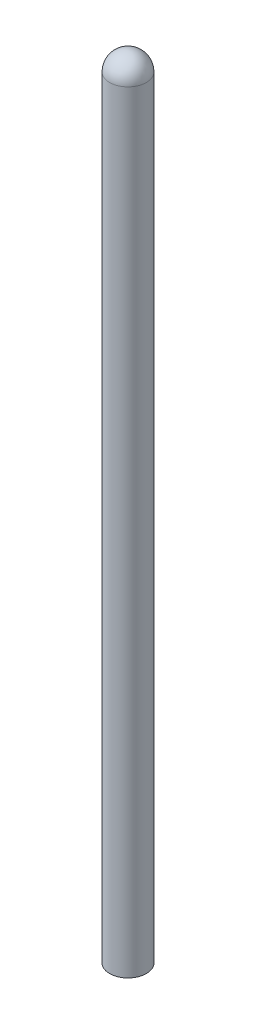
from build123d import *
from build123d.topology import SkipClean

# Parameters (mm, degrees)
SKETCH2_R           = 2.5
BOSS_EXTRUDE1_DEPTH = 105


with BuildPart() as part:
    # Sketch2 → Boss-Extrude1 (new body)
    with BuildSketch(Plane(origin=(0, 0, 0), x_dir=(1, 0, 0), z_dir=(0, 1, 0))):
        with Locations(Location((0, 0, 0), (0, 0, 270))):
            Circle(SKETCH2_R)
    extrude(amount=BOSS_EXTRUDE1_DEPTH)

    # Sketch3 → Revolve1 (revolve)
    with SkipClean():  # the faces are left unmerged after this step: merging them gives an invalid solid
        with BuildSketch(Plane(origin=(0, 0, 0), x_dir=(0, 0, -1), z_dir=(1, 0, 0))):
            with BuildLine():
                Line((-2.5, 105), (2.5, 105))
                ThreePointArc((2.5, 105), (0, 107.5), (-2.5, 105))
            make_face()
        revolve(axis=Axis((0, 105, 2.5), (0, 0, -1)))


solid = part.part
